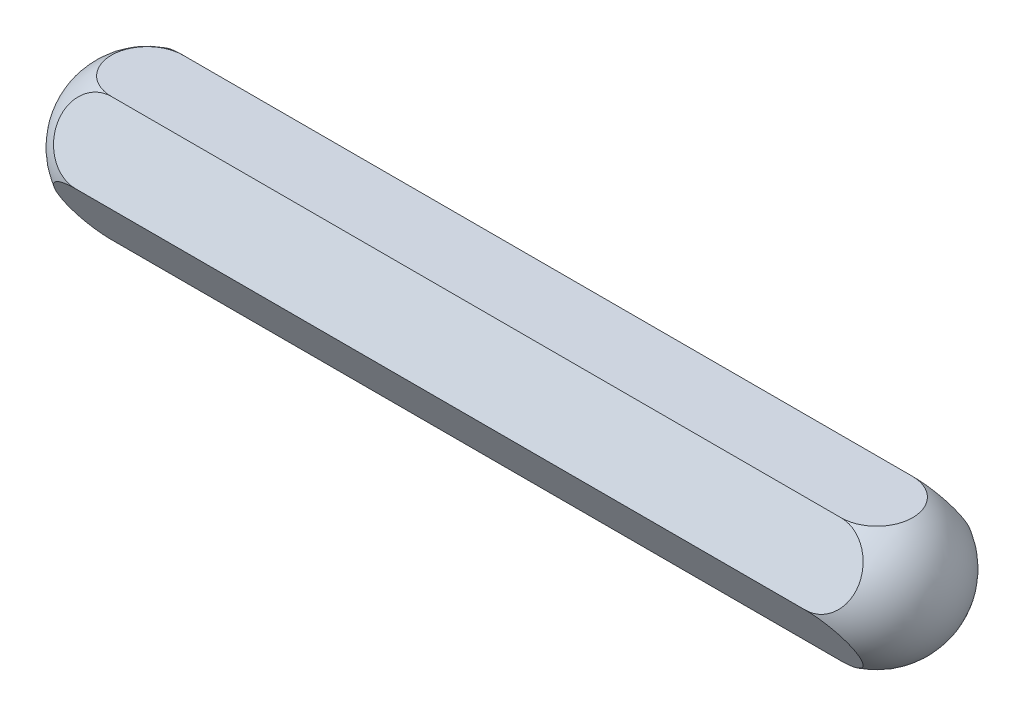
from build123d import *

# Parameters (mm, degrees)
OCTAGONAL_CUT_DEPTH      = 27.280030441382678
OCTAGONAL_CUT_DEPTH_BACK = 27.280030441382678


with BuildPart() as part:
    # Sketch1 → Body Revolve (revolve)
    with BuildSketch(Plane.XY):
        with BuildLine():
            Line((-21.400000000000002, 4.2), (21.400000000000002, 4.200000000000008))
            ThreePointArc((21.400000000000002, 4.200000000000008), (24.3698484809835, 2.9698484809835084), (25.6, 9.41e-15))
            Line((25.6, 9.41e-15), (-25.6, 0))
            ThreePointArc((-25.6, 0), (-24.369848480983503, 2.9698484809835), (-21.400000000000002, 4.2))
        make_face()
    revolve(axis=Axis((-25.6, 0, 0), (1, 1.8e-16, 0)))

    # Sketch2 → Octagonal Cut (cut, two sides: drawn at the far end of the back side and taken through both)
    with BuildSketch(Plane(origin=(0, 0, 0), x_dir=(0, 0, -1), z_dir=(1, 0, 0)).offset(-OCTAGONAL_CUT_DEPTH_BACK)):
        with BuildLine():
            Line((-4.1999999999999975, 8.44e-15), (-2.0999999999999983, 3.637306695894651))
            ThreePointArc((-2.099999999999999, 3.637306695894651), (-3.6373066958946416, 2.10000000000001), (-4.2, 9.15e-15))
        make_face()
        with BuildLine():
            ThreePointArc((2.1000000000000005, 3.6373066958946505), (2.6e-16, 4.200000000000009), (-2.099999999999999, 3.637306695894651))
            Line((-2.0999999999999983, 3.637306695894651), (2.1, 3.6373066958946496))
        make_face()
        with BuildLine():
            ThreePointArc((4.2, 8.63e-15), (3.6373066958946425, 2.100000000000008), (2.1000000000000005, 3.6373066958946505))
            Line((2.1, 3.6373066958946496), (4.199999999999999, 8.08e-15))
        make_face()
        with BuildLine():
            ThreePointArc((2.1000000000000005, -3.6373066958946336), (3.6373066958946434, -2.0999999999999903), (4.2, 7.61e-15))
            Line((4.199999999999999, 7.99e-15), (2.1, -3.6373066958946327))
        make_face()
        with BuildLine():
            Line((2.1000000000000005, -3.6373066958946327), (-2.0999999999999988, -3.637306695894634))
            ThreePointArc((-2.0999999999999983, -3.637306695894635), (-7.7e-16, -4.199999999999991), (2.1000000000000005, -3.6373066958946336))
        make_face()
        with BuildLine():
            Line((-2.0999999999999988, -3.637306695894634), (-4.1999999999999975, 8.2e-15))
            ThreePointArc((-4.2, 9.15e-15), (-3.637306695894642, -2.099999999999992), (-2.0999999999999983, -3.637306695894635))
        make_face()
    extrude(amount=OCTAGONAL_CUT_DEPTH + OCTAGONAL_CUT_DEPTH_BACK, mode=Mode.SUBTRACT)


solid = part.part
